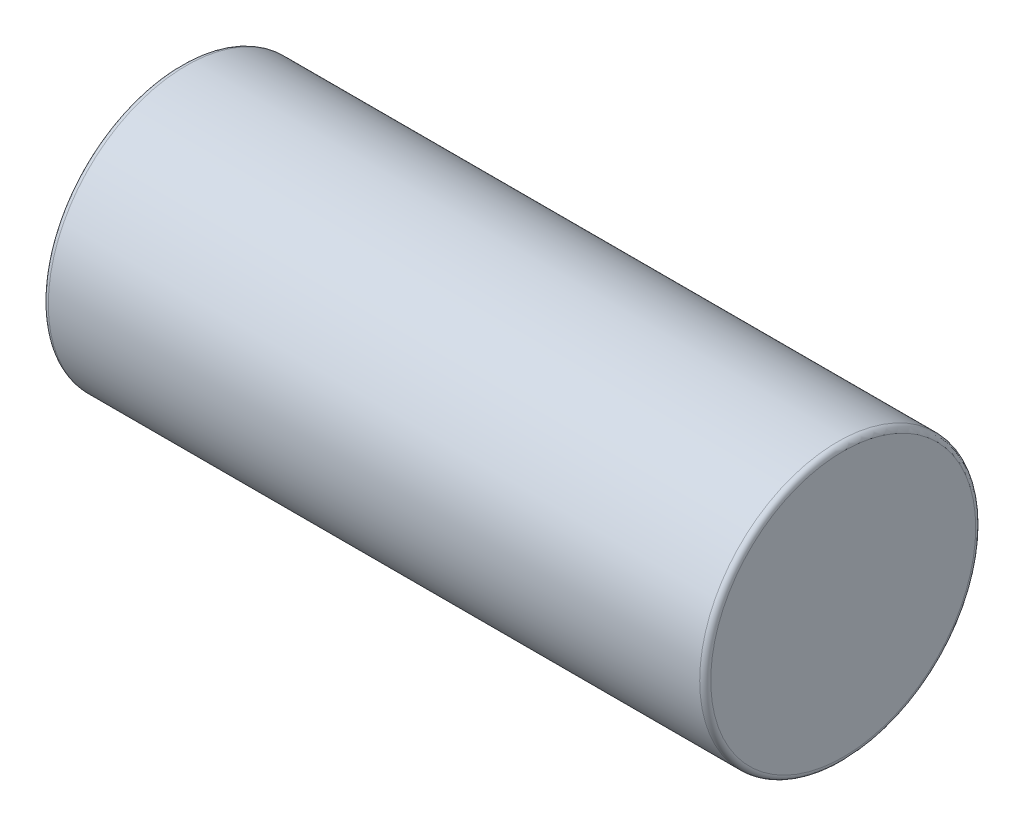
from build123d import *

# Parameters (mm, degrees)
SKETCH1_R           = 63.5
BOSS_EXTRUDE1_DEPTH = 152.4
FILLET1_R           = 2.54


with BuildPart() as part:
    # Sketch1 → Boss-Extrude1 (new, symmetric)
    with BuildSketch(Plane(origin=(0, 0, 0), x_dir=(0, 0, -1), z_dir=(1, 0, 0))):
        with Locations(Location((0, 0, 0), (0, 0, 180))):
            Circle(SKETCH1_R)
    extrude(amount=BOSS_EXTRUDE1_DEPTH, both=True)

    # Fillet1
    fillet1_edges = [part.edges().sort_by_distance(p)[0] for p in [
        (-152.4, 0, -63.5),
        (152.4, 0, -63.5),
    ]]
    fillet(fillet1_edges, radius=FILLET1_R)


solid = part.part
